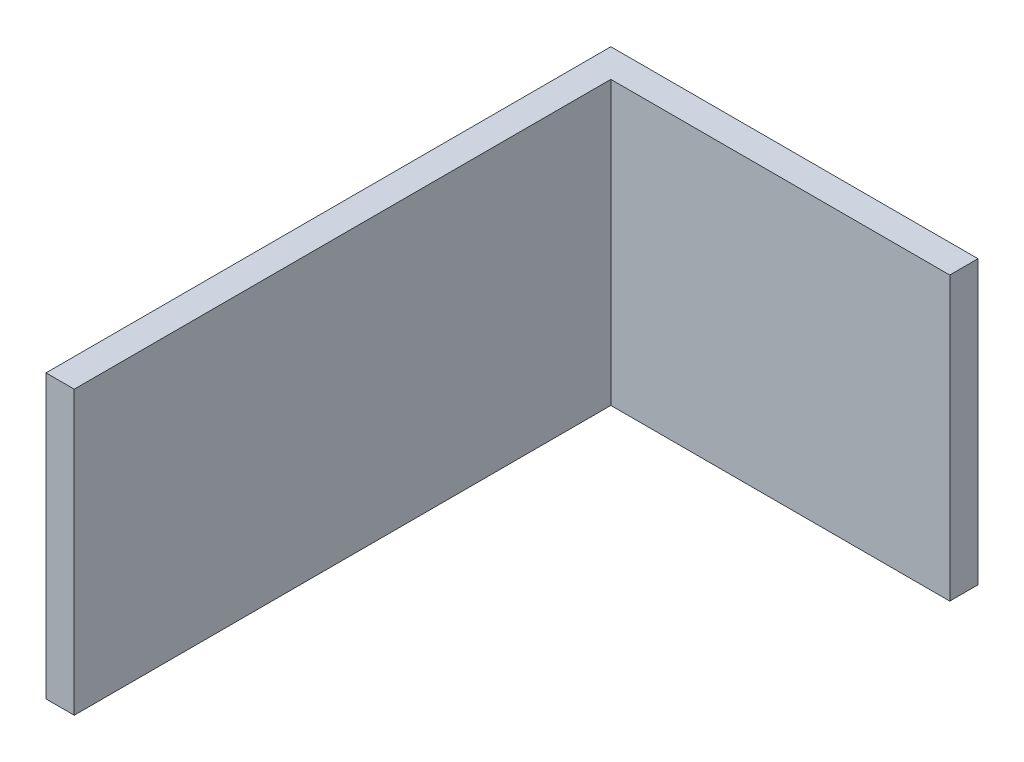
from build123d import *

# Parameters (mm, degrees)
SKETCH2_W           = 500
SKETCH2_H           = 5000
BOSS_EXTRUDE1_DEPTH = 10000
SKETCH3_W           = 500
SKETCH3_H           = 5000
BOSS_EXTRUDE2_DEPTH = 6000


with BuildPart() as part:
    # Sketch2 → Boss-Extrude1 (new body)
    with BuildSketch(Plane.XY):
        with Locations((250, 2500)):
            Rectangle(SKETCH2_W, SKETCH2_H)
    extrude(amount=BOSS_EXTRUDE1_DEPTH)

    # Sketch3 → Boss-Extrude2 (add)
    with BuildSketch(Plane(origin=(500, 0, 0), x_dir=(0, 0, -1), z_dir=(1, 0, 0))):
        with Locations((-250, 2500)):
            Rectangle(SKETCH3_W, SKETCH3_H)
    extrude(amount=BOSS_EXTRUDE2_DEPTH)


solid = part.part
